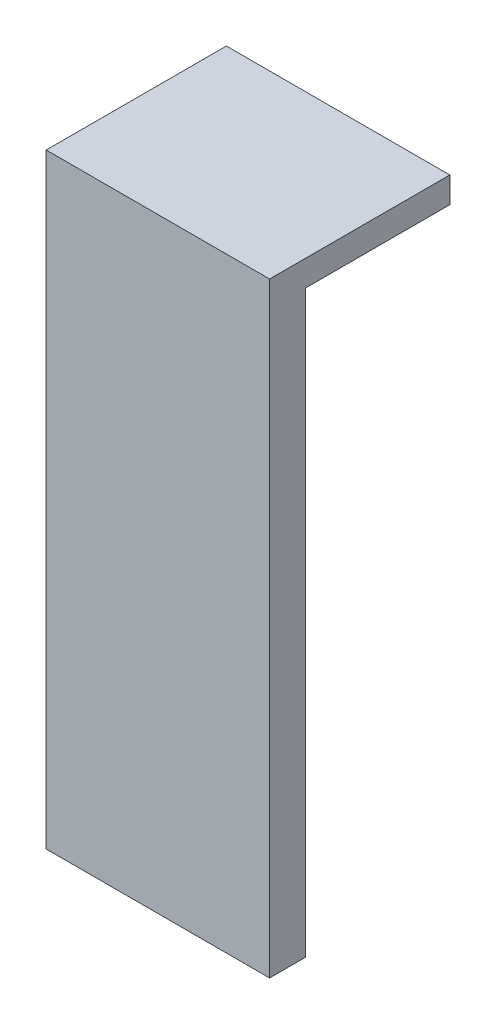
from build123d import *

# Parameters (mm, degrees)
SKETCH1_W           = 7.874
SKETCH1_H           = 1.27
BOSS_EXTRUDE1_DEPTH = 21.336
SKETCH2_W           = 7.874
SKETCH2_H           = 0.908244578
BOSS_EXTRUDE2_DEPTH = 5.08


with BuildPart() as part:
    # Sketch1 → Boss-Extrude1 (new body)
    with BuildSketch(Plane(origin=(0, 0, 0), x_dir=(1, 0, 0), z_dir=(0, 1, 0))):
        with Locations((-0.3175, 0.635)):
            Rectangle(SKETCH1_W, SKETCH1_H)
    extrude(amount=BOSS_EXTRUDE1_DEPTH)

    # Sketch2 → Boss-Extrude2 (add)
    with BuildSketch(Plane(origin=(0, 0, -1.27), x_dir=(-1, 0, 0), z_dir=(0, 0, -1))):
        with Locations((0.3175, 20.881877711)):
            Rectangle(SKETCH2_W, SKETCH2_H)
    extrude(amount=BOSS_EXTRUDE2_DEPTH)


solid = part.part
